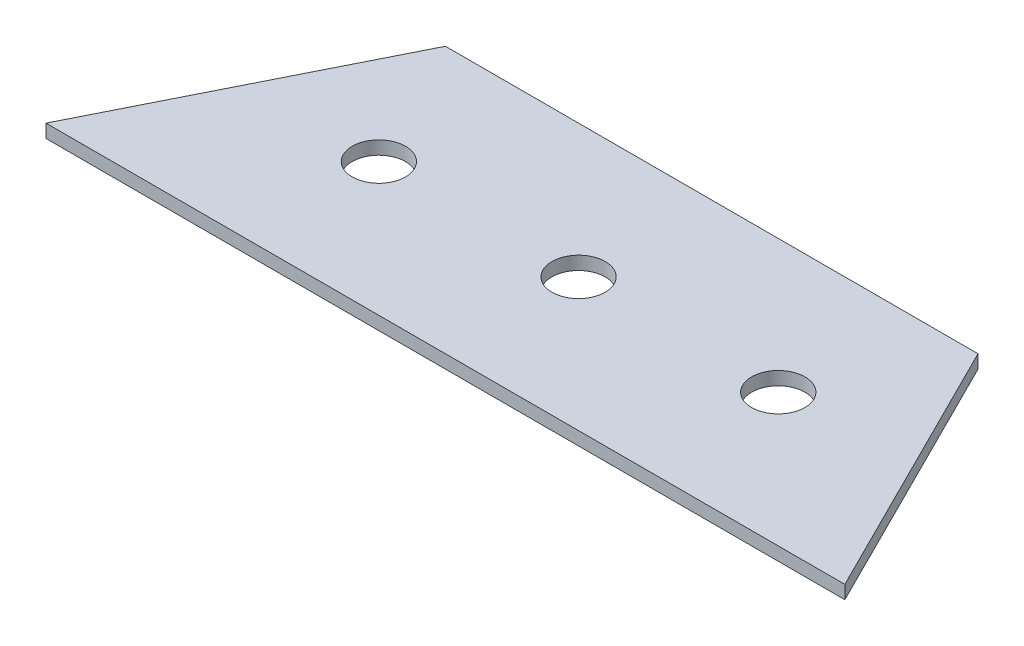
from build123d import *

# Parameters (mm, degrees)
BOSS_EXTRUDE1_DEPTH = 2.54
SKETCH2_R           = 5.08
CUT_EXTRUDE1_DEPTH  = 161.663784345


with BuildPart() as part:
    # Sketch1 → Boss-Extrude1 (new body)
    with BuildSketch(Plane(origin=(0, 0, 0), x_dir=(1, 0, 0), z_dir=(0, 1, 0))):
        Polygon((0, 0), (-152.4, 0), (-127, 50.8), (-25.4, 50.8), align=None)
    extrude(amount=BOSS_EXTRUDE1_DEPTH)

    # Sketch2 → Cut-Extrude1 (cut, through all)
    with BuildSketch(Plane(origin=(0, 2.54, 0), x_dir=(1, 0, 0), z_dir=(0, 1, 0))):
        with Locations(Location((-76.2, 25.4, 0), (0, 0, 270))):
            Circle(SKETCH2_R)
        with Locations(Location((-114.3, 25.4, 0), (0, 0, 270))):
            Circle(SKETCH2_R)
        with Locations(Location((-38.1, 25.4, 0), (0, 0, 270))):
            Circle(SKETCH2_R)
    extrude(amount=-CUT_EXTRUDE1_DEPTH, mode=Mode.SUBTRACT)


solid = part.part
